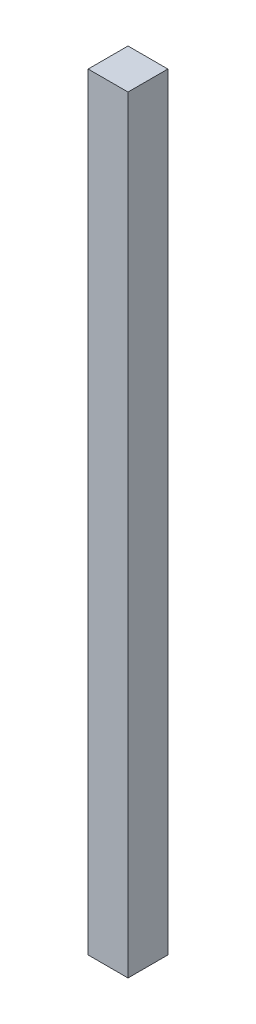
from build123d import *

# Parameters (mm, degrees)
ESBO_O1_W                = 0.6
ESBO_O1_H                = 0.6
RESSALTO_EXTRUS_O1_DEPTH = 11.55


with BuildPart() as part:
    # Esboço1 → Ressalto-extrusão1 (new body)
    with BuildSketch(Plane(origin=(0, 0, 0), x_dir=(1, 0, 0), z_dir=(0, 1, 0))):
        Rectangle(ESBO_O1_W, ESBO_O1_H)
    extrude(amount=RESSALTO_EXTRUS_O1_DEPTH)


solid = part.part
